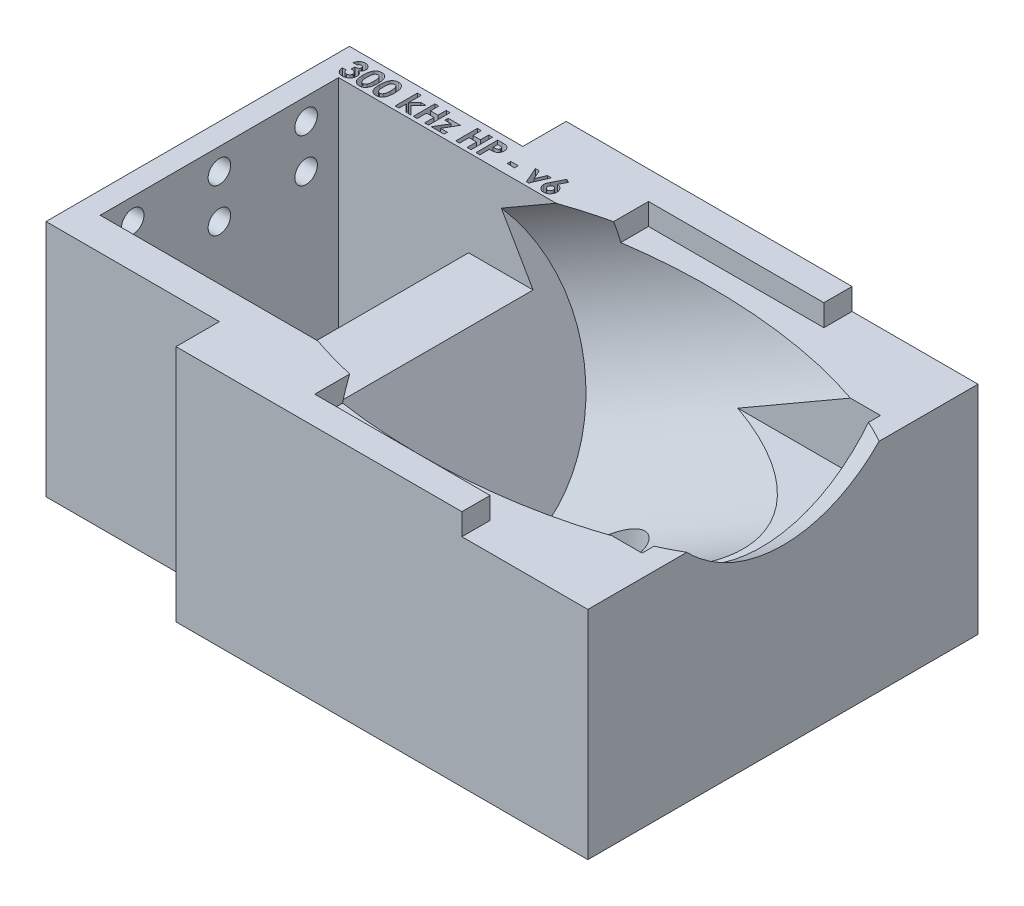
from build123d import *

# Parameters (mm, degrees)
SKETCH1_W                       = 228.6
SKETCH1_H                       = 127
BOSS_EXTRUDE1_DEPTH             = 50.8
SKETCH10_R                      = 12.7
CUT_EXTRUDE6_DEPTH              = 196.514014843
SKETCH22_W                      = 25.4
SKETCH22_H                      = 101.6
CUT_EXTRUDE17_DEPTH             = 196.514014908
SKETCH23_W                      = 254
SKETCH23_H                      = 254
CUT_EXTRUDE18_DEPTH             = 57.15
SKETCH21_W                      = 31.75
SKETCH21_H                      = 101.6
CUT_EXTRUDE16_DEPTH             = 144.262530042
SKETCH26_W                      = 158.75
SKETCH26_H                      = 69.85
CUT_EXTRUDE21_DEPTH             = 25.4
CUT_EXTRUDE22_REACH             = 193.976
SKETCH27_R                      = 3.302
CUT_EXTRUDE22_DIRECTION_2_DEPTH = 192.97594914
SKETCH28_W                      = 2.198076923
SKETCH28_H                      = 1.058333333
CUT_EXTRUDE23_DEPTH             = 3.175
SKETCH30_R                      = 3.429
CUT_EXTRUDE24_DEPTH             = 133.743860656
SKETCH31_W                      = 38.1
SKETCH31_H                      = 69.85
CUT_EXTRUDE25_DEPTH             = 38.1
SKETCH32_W                      = 88.276157737
SKETCH32_H                      = 97.79
CUT_EXTRUDE26_DEPTH             = 6.35
SKETCH33_W                      = 36.899714507
SKETCH33_H                      = 101.6
CUT_EXTRUDE27_DEPTH             = 6.35
BOSS_EXTRUDE2_DEPTH             = 6.35
BOSS_EXTRUDE3_DEPTH             = 6.35
SKETCH36_W                      = 50.8
SKETCH36_H                      = 12.7
CUT_EXTRUDE28_DEPTH             = 146.635280919


with BuildPart() as part:
    # Sketch1 → Boss-Extrude1 (new, symmetric)
    with BuildSketch(Plane.XY):
        with Locations((-25.4, -63.5)):
            Rectangle(SKETCH1_W, SKETCH1_H)
    extrude(amount=BOSS_EXTRUDE1_DEPTH, both=True)

    # Sketch10 → Cut-Extrude6 (cut, through all)
    with BuildSketch(Plane.XZ.offset(127)):
        with Locations(Location((0, 0, 0), (0, 0, 270))):
            Circle(SKETCH10_R)
    extrude(amount=-CUT_EXTRUDE6_DEPTH, mode=Mode.SUBTRACT)

    # Sketch2 → Cut-Revolve1 (revolve, cut)
    with BuildSketch(Plane.XY):
        Polygon((0, 46.586734405), (-47.920101674, 18.920050804), (-69.397531628, 6.520050839), (-50.142509297, -26.830626138), (-48.125031628, -30.324999965), (0, -2.54), (87.988181024, 48.26), (66.715681024, 85.105050804), align=None)
    revolve(axis=Axis((-48.125031628, -30.324999965, 0), (0.8660254037844379, 0.5000000000000012, 0)), mode=Mode.SUBTRACT)

    # Sketch22 → Cut-Extrude17 (cut, through all)
    with BuildSketch(Plane(origin=(0, 0, 0), x_dir=(1, 0, 0), z_dir=(0, 1, 0))):
        with Locations((-127, 0)):
            Rectangle(SKETCH22_W, SKETCH22_H)
    extrude(amount=-CUT_EXTRUDE17_DEPTH, mode=Mode.SUBTRACT)

    # Sketch23 → Cut-Extrude18 (cut)
    with BuildSketch(Plane.XZ.offset(127)):
        Rectangle(SKETCH23_W, SKETCH23_H)
    extrude(amount=-CUT_EXTRUDE18_DEPTH, mode=Mode.SUBTRACT)

    # Sketch21 → Cut-Extrude16 (cut, through all)
    with BuildSketch(Plane(origin=(0, 0, 0), x_dir=(1, 0, 0), z_dir=(0, 1, 0))):
        with Locations((73.025, 0)):
            Rectangle(SKETCH21_W, SKETCH21_H)
    extrude(amount=-CUT_EXTRUDE16_DEPTH, mode=Mode.SUBTRACT)

    # Sketch26 → Cut-Extrude21 (cut)
    with BuildSketch(Plane(origin=(0, 0, 0), x_dir=(1, 0, 0), z_dir=(0, 1, 0))):
        with Locations((-28.575, 0)):
            Rectangle(SKETCH26_W, SKETCH26_H)
    extrude(amount=-CUT_EXTRUDE21_DEPTH, mode=Mode.SUBTRACT)

    # Sketch27 → Cut-Extrude22 (cut, up to next)
    with BuildSketch(Plane.ZY.offset(114.3), mode=Mode.PRIVATE) as cut_extrude22_sk1:
        with Locations(Location((-25.4, -6.35, 0), (0, 0, 180))):
            Circle(SKETCH27_R)
    cut_extrude22_tool1 = extrude(cut_extrude22_sk1.sketch, amount=-CUT_EXTRUDE22_REACH, mode=Mode.PRIVATE) & part.part
    # Sketch27 → Cut-Extrude22 (cut, up to next)
    with BuildSketch(Plane.ZY.offset(114.3), mode=Mode.PRIVATE) as cut_extrude22_sk2:
        with Locations(Location((0, -6.35, 0), (0, 0, 180))):
            Circle(SKETCH27_R)
    cut_extrude22_tool2 = extrude(cut_extrude22_sk2.sketch, amount=-CUT_EXTRUDE22_REACH, mode=Mode.PRIVATE) & part.part
    # Sketch27 → Cut-Extrude22 (cut, up to next)
    with BuildSketch(Plane.ZY.offset(114.3), mode=Mode.PRIVATE) as cut_extrude22_sk3:
        with Locations(Location((0, -19.05, 0), (0, 0, 180))):
            Circle(SKETCH27_R)
    cut_extrude22_tool3 = extrude(cut_extrude22_sk3.sketch, amount=-CUT_EXTRUDE22_REACH, mode=Mode.PRIVATE) & part.part
    # Sketch27 → Cut-Extrude22 (cut, up to next)
    with BuildSketch(Plane.ZY.offset(114.3), mode=Mode.PRIVATE) as cut_extrude22_sk4:
        with Locations(Location((25.4, -6.35, 0), (0, 0, 180))):
            Circle(SKETCH27_R)
    cut_extrude22_tool4 = extrude(cut_extrude22_sk4.sketch, amount=-CUT_EXTRUDE22_REACH, mode=Mode.PRIVATE) & part.part
    # Sketch27 → Cut-Extrude22 (cut, up to next)
    with BuildSketch(Plane.ZY.offset(114.3), mode=Mode.PRIVATE) as cut_extrude22_sk5:
        with Locations(Location((25.4, -19.05, 0), (0, 0, 180))):
            Circle(SKETCH27_R)
    cut_extrude22_tool5 = extrude(cut_extrude22_sk5.sketch, amount=-CUT_EXTRUDE22_REACH, mode=Mode.PRIVATE) & part.part
    # Sketch27 → Cut-Extrude22 (cut, up to next)
    with BuildSketch(Plane.ZY.offset(114.3), mode=Mode.PRIVATE) as cut_extrude22_sk6:
        with Locations(Location((-25.4, -19.05, 0), (0, 0, 180))):
            Circle(SKETCH27_R)
    cut_extrude22_tool6 = extrude(cut_extrude22_sk6.sketch, amount=-CUT_EXTRUDE22_REACH, mode=Mode.PRIVATE) & part.part
    add(cut_extrude22_tool1.solids().sort_by_distance((-114.3, -6.35, -25.4))[0], mode=Mode.SUBTRACT)
    add(cut_extrude22_tool2.solids().sort_by_distance((-114.3, -6.35, 0))[0], mode=Mode.SUBTRACT)
    add(cut_extrude22_tool3.solids().sort_by_distance((-114.3, -19.05, 0))[0], mode=Mode.SUBTRACT)
    add(cut_extrude22_tool4.solids().sort_by_distance((-114.3, -6.35, 25.4))[0], mode=Mode.SUBTRACT)
    add(cut_extrude22_tool5.solids().sort_by_distance((-114.3, -19.05, 25.4))[0], mode=Mode.SUBTRACT)
    add(cut_extrude22_tool6.solids().sort_by_distance((-114.3, -19.05, -25.4))[0], mode=Mode.SUBTRACT)

    # Sketch27 → Cut-Extrude22 direction 2 (cut)
    with BuildSketch(Plane.ZY.offset(114.3)):
        with Locations(Location((-25.4, -6.35, 0), (0, 0, 180))):
            Circle(SKETCH27_R)
        with Locations(Location((0, -6.35, 0), (0, 0, 180))):
            Circle(SKETCH27_R)
        with Locations(Location((0, -19.05, 0), (0, 0, 180))):
            Circle(SKETCH27_R)
        with Locations(Location((25.4, -6.35, 0), (0, 0, 180))):
            Circle(SKETCH27_R)
        with Locations(Location((25.4, -19.05, 0), (0, 0, 180))):
            Circle(SKETCH27_R)
        with Locations(Location((-25.4, -19.05, 0), (0, 0, 180))):
            Circle(SKETCH27_R)
    extrude(amount=CUT_EXTRUDE22_DIRECTION_2_DEPTH, mode=Mode.SUBTRACT)

    # Sketch28 → Cut-Extrude23 (cut)
    # profile 1 of 11: a face of its own
    with BuildSketch(Plane(origin=(0, 0, 0), x_dir=(1, 0, 0), z_dir=(0, 1, 0))):
        with BuildLine():
            Line((-108.439595668, 40.823041991), (-109.579339258, 40.823041991))
            add(Edge.make_bspline(
                [(-109.579339258, 40.823041991), (-109.571292235, 40.880013707), (-109.555516579, 40.991702982), (-109.517767544, 41.15340123), (-109.472615625, 41.306783084), (-109.41624576, 41.451362816), (-109.35013308, 41.587397969), (-109.274949876, 41.71535535), (-109.18988339, 41.834685743), (-109.124679027, 41.906570845), (-109.092149755, 41.942433016)],
                knots=[0, 0, 0, 0, 1.111473889, 2.178970933, 3.205615836, 4.199322666, 5.174200091, 6.12565194, 7.064921805, 8, 8, 8, 8], degree=3))
            add(Edge.make_bspline(
                [(-109.092149755, 41.942433016), (-109.04523059, 41.989750553), (-108.952757848, 42.083008445), (-108.798225049, 42.202461503), (-108.636246138, 42.305840002), (-108.463572556, 42.387799223), (-108.282891233, 42.454135718), (-108.092765331, 42.498694091), (-107.893971771, 42.528258965), (-107.758320175, 42.531171208), (-107.689094867, 42.532657375)],
                knots=[0, 0, 0, 0, 1.01925491, 2.00884431, 2.983262333, 3.955970413, 4.92937149, 5.924503185, 6.940838805, 8, 8, 8, 8], degree=3))
            add(Edge.make_bspline(
                [(-107.689094867, 42.532657375), (-107.627550006, 42.531204422), (-107.506565211, 42.528348208), (-107.328748005, 42.505420072), (-107.15921418, 42.465206676), (-106.996171714, 42.412628563), (-106.84201843, 42.341087252), (-106.693352017, 42.258043018), (-106.554326218, 42.156185813), (-106.42461574, 42.041097423), (-106.305451927, 41.916618062), (-106.202255542, 41.783559862), (-106.113535759, 41.645477115), (-106.040442393, 41.501222613), (-105.984243527, 41.350552262), (-105.945239847, 41.194336462), (-105.919710992, 41.032919917), (-105.917167651, 40.923207266), (-105.915877719, 40.867563225)],
                knots=[0, 0, 0, 0, 1.091422571, 2.145516843, 3.172569842, 4.178562979, 5.178154469, 6.181868002, 7.194278174, 8.227918432, 9.254613415, 10.245994977, 11.209837596, 12.161663635, 13.10878368, 14.055455738, 15.013766427, 16, 16, 16, 16], degree=3))
            add(Edge.make_bspline(
                [(-105.915877719, 40.867563225), (-105.918524735, 40.798652714), (-105.923735896, 40.662989104), (-105.966497241, 40.464435331), (-106.033430374, 40.274582491), (-106.130121795, 40.09608691), (-106.251010699, 39.929434354), (-106.399337334, 39.780196517), (-106.570876975, 39.646033552), (-106.699654067, 39.573934358), (-106.765597271, 39.537014347)],
                knots=[0, 0, 0, 0, 0.992805628, 1.954529043, 2.915727527, 3.886831945, 4.871318353, 5.87440735, 6.911542536, 8, 8, 8, 8], degree=3))
            add(Edge.make_bspline(
                [(-106.765597271, 39.537014347), (-106.720334868, 39.522153747), (-106.631396276, 39.492953334), (-106.504980761, 39.435443453), (-106.384774052, 39.372594684), (-106.272846064, 39.299580983), (-106.16808354, 39.2193547), (-106.071125122, 39.13123003), (-105.981391508, 39.035399128), (-105.900347562, 38.931334959), (-105.828417893, 38.820701827), (-105.763879232, 38.706055293), (-105.710760316, 38.58565672), (-105.665761981, 38.460881142), (-105.631502811, 38.330607142), (-105.607381294, 38.195339519), (-105.593438465, 38.05538683), (-105.591311945, 37.960568968), (-105.590236694, 37.912625324)],
                knots=[0, 0, 0, 0, 1.059543567, 2.081955587, 3.086750234, 4.076226789, 5.052108497, 6.020845489, 6.989030705, 7.970690546, 8.952259656, 9.923888338, 10.895517021, 11.877585046, 12.873342345, 13.889638361, 14.932918083, 16, 16, 16, 16], degree=3))
            add(Edge.make_bspline(
                [(-105.590236694, 37.912625324), (-105.592416374, 37.842167634), (-105.596714258, 37.703239418), (-105.624038199, 37.498612373), (-105.674910453, 37.303518667), (-105.741835722, 37.11571345), (-105.831106766, 36.937621221), (-105.936163778, 36.765155005), (-106.065299953, 36.604295884), (-106.208812638, 36.450791159), (-106.368191842, 36.311231537), (-106.540984827, 36.190239624), (-106.723392024, 36.086407035), (-106.916567472, 36.002112782), (-107.120444057, 35.937196566), (-107.334567356, 35.890272133), (-107.559837056, 35.861562988), (-107.713601251, 35.858553379), (-107.792129723, 35.85701635)],
                knots=[0, 0, 0, 0, 1.005138573, 1.981928558, 2.936866704, 3.876260664, 4.820238198, 5.773547, 6.751179199, 7.756627054, 8.768222608, 9.766606018, 10.760583154, 11.757261445, 12.767156078, 13.807575856, 14.880313354, 16, 16, 16, 16], degree=3))
            add(Edge.make_bspline(
                [(-107.792129723, 35.85701635), (-107.86641639, 35.858636887), (-108.011674137, 35.861805633), (-108.224143994, 35.889232737), (-108.426076481, 35.933474881), (-108.617986934, 35.995837851), (-108.799132866, 36.076711966), (-108.971156979, 36.173014891), (-109.13062657, 36.290301154), (-109.279318443, 36.423276232), (-109.413934166, 36.57246672), (-109.53424892, 36.734416693), (-109.637609746, 36.909741981), (-109.724440526, 37.097693522), (-109.79406244, 37.298601039), (-109.848980002, 37.512055976), (-109.887340818, 37.738475358), (-109.899023685, 37.894256709), (-109.904980283, 37.973683016)],
                knots=[0, 0, 0, 0, 1.066544725, 2.085487077, 3.070979577, 4.031932826, 4.977951092, 5.916076795, 6.857635327, 7.814973522, 8.776389752, 9.738577119, 10.707772778, 11.69409279, 12.707140348, 13.757286496, 14.856535458, 16, 16, 16, 16], degree=3))
            Line((-109.904980283, 37.973683016), (-108.765236694, 37.973683016))
            add(Edge.make_bspline(
                [(-108.765236694, 37.973683016), (-108.758014257, 37.933746426), (-108.743946669, 37.855959444), (-108.7165087, 37.743341187), (-108.680753198, 37.639387579), (-108.639410942, 37.543174684), (-108.594755082, 37.453439261), (-108.540800124, 37.373495461), (-108.481499604, 37.301172481), (-108.395928521, 37.215194125), (-108.273598765, 37.126854954), (-108.108413067, 37.050084011), (-107.92465962, 37.005086807), (-107.796197635, 36.999597286), (-107.729799995, 36.996759939)],
                knots=[0, 0, 0, 0, 0.928156231, 1.807827665, 2.648129825, 3.438902246, 4.202261636, 4.936546065, 5.639352463, 6.338805438, 7.70633318, 9.064371875, 10.482673459, 12, 12, 12, 12], degree=3))
            add(Edge.make_bspline(
                [(-107.729799995, 36.996759939), (-107.69456706, 36.997364126), (-107.625553623, 36.998547592), (-107.524183161, 37.011664725), (-107.427613522, 37.033268655), (-107.335664841, 37.062627594), (-107.247751768, 37.09943086), (-107.165553968, 37.146886469), (-107.087396046, 37.202060389), (-107.01412765, 37.264090522), (-106.946426141, 37.331681163), (-106.890094505, 37.406526313), (-106.838611465, 37.482582364), (-106.800534238, 37.564825169), (-106.767170384, 37.648829187), (-106.746750001, 37.7376435), (-106.731331146, 37.829405024), (-106.730435064, 37.892202582), (-106.729980283, 37.924073641)],
                knots=[0, 0, 0, 0, 1.110435564, 2.175094844, 3.216326037, 4.226890168, 5.215276772, 6.21526065, 7.213097102, 8.228249917, 9.239874822, 10.221364777, 11.178138315, 12.128914389, 13.072518965, 14.022636769, 14.996447288, 16, 16, 16, 16], degree=3))
            add(Edge.make_bspline(
                [(-106.729980283, 37.924073641), (-106.73118764, 37.958930074), (-106.733591209, 38.028321246), (-106.753228623, 38.129583069), (-106.784240251, 38.226988782), (-106.827319189, 38.320107026), (-106.88484631, 38.408594586), (-106.952727671, 38.49422679), (-107.036311201, 38.572546634), (-107.128013528, 38.649963427), (-107.234352201, 38.717447522), (-107.350148378, 38.779725426), (-107.478445363, 38.829279411), (-107.616111312, 38.873540297), (-107.765750304, 38.905867762), (-107.926433137, 38.929340651), (-108.097900607, 38.94681258), (-108.216095362, 38.949319216), (-108.276775155, 38.950606093)],
                knots=[0, 0, 0, 0, 0.809814727, 1.612155564, 2.388397, 3.182215007, 3.988903953, 4.837162975, 5.715530372, 6.646997145, 7.623086902, 8.637258368, 9.698941581, 10.815059213, 11.996518529, 13.252603015, 14.589518788, 16, 16, 16, 16], degree=3))
            Line((-108.276775155, 38.950606093), (-108.276775155, 40.008939427))
            add(Edge.make_bspline(
                [(-108.276775155, 40.008939427), (-108.201225204, 40.015373502), (-108.059886206, 40.027410384), (-107.863700099, 40.055559049), (-107.698536686, 40.093184375), (-107.560426262, 40.138577293), (-107.445748216, 40.196873627), (-107.345566107, 40.261230206), (-107.259284537, 40.335970966), (-107.186365035, 40.418867149), (-107.128031703, 40.507889877), (-107.086746769, 40.601655471), (-107.059484355, 40.69726271), (-107.056901244, 40.762655179), (-107.055621309, 40.795057215)],
                knots=[0, 0, 0, 0, 1.70044513, 3.18119609, 4.440695891, 5.496282586, 6.431922213, 7.318171381, 8.16090191, 8.983045123, 9.787564368, 10.536848927, 11.275007137, 12, 12, 12, 12], degree=3))
            add(Edge.make_bspline(
                [(-107.055621309, 40.795057215), (-107.057829562, 40.836398695), (-107.062139605, 40.917088511), (-107.095613734, 41.032572635), (-107.153721029, 41.135517161), (-107.231632708, 41.225705463), (-107.326570798, 41.301037492), (-107.437854882, 41.355727261), (-107.56307009, 41.387859942), (-107.651165735, 41.391191018), (-107.696727078, 41.392913786)],
                knots=[0, 0, 0, 0, 1.009664648, 1.970651636, 2.907870547, 3.878035693, 4.867062054, 5.849714035, 6.887914197, 8, 8, 8, 8], degree=3))
            add(Edge.make_bspline(
                [(-107.696727078, 41.392913786), (-107.738023313, 41.390881101), (-107.819967691, 41.386847633), (-107.939794899, 41.356742892), (-108.053590825, 41.306065308), (-108.158999075, 41.236183907), (-108.254498061, 41.152259306), (-108.332875175, 41.052868036), (-108.398065543, 40.9439648), (-108.425698023, 40.863507611), (-108.439595668, 40.823041991)],
                knots=[0, 0, 0, 0, 0.98818071, 1.960853194, 2.938124878, 3.957524365, 4.978590984, 5.968022688, 6.978025184, 8, 8, 8, 8], degree=3))
        make_face()
    # profile 2 of 11: a face of its own
    with BuildSketch(Plane(origin=(0, 0, 0), x_dir=(1, 0, 0), z_dir=(0, 1, 0))):
        with BuildLine():
            add(Edge.make_bspline(
                [(-102.882073633, 42.532657375), (-102.826905313, 42.531838386), (-102.718429655, 42.530228034), (-102.55866543, 42.512786614), (-102.40476831, 42.486437491), (-102.25613623, 42.449689654), (-102.113839057, 42.401055199), (-101.976841125, 42.342840591), (-101.846773105, 42.271992353), (-101.721976214, 42.19196563), (-101.602498525, 42.101364034), (-101.491211599, 41.998073537), (-101.386083101, 41.884470857), (-101.289388676, 41.758838526), (-101.198986996, 41.622319302), (-101.115175106, 41.474891538), (-101.038594608, 41.315833674), (-100.968387215, 41.144858678), (-100.905607543, 40.959403708), (-100.852728303, 40.757341515), (-100.807375507, 40.538625954), (-100.769094546, 40.302712611), (-100.740160327, 40.049287898), (-100.720658081, 39.77852018), (-100.707274717, 39.490931456), (-100.70618246, 39.293647954), (-100.705621309, 39.192292792)],
                knots=[0, 0, 0, 0, 0.879237366, 1.728815576, 2.559023295, 3.367336655, 4.166867292, 4.954216142, 5.737608147, 6.525189134, 7.316157332, 8.124696809, 8.942788509, 9.781158001, 10.649253743, 11.551476218, 12.482711956, 13.461909668, 14.496590415, 15.601789533, 16.789733467, 18.056700938, 19.410929216, 20.8549011, 22.384193279, 24, 24, 24, 24], degree=3))
            add(Edge.make_bspline(
                [(-100.705621309, 39.192292792), (-100.706227762, 39.089669563), (-100.707406089, 38.89027447), (-100.720101731, 38.600055314), (-100.741964227, 38.327321659), (-100.770142189, 38.072101723), (-100.80873829, 37.834530282), (-100.853939689, 37.613992186), (-100.907653612, 37.410567376), (-100.972501226, 37.22471421), (-101.042283652, 37.053438944), (-101.119073631, 36.894691206), (-101.201532725, 36.748041017), (-101.287769572, 36.611275962), (-101.382511992, 36.488427804), (-101.481148604, 36.375319063), (-101.587974223, 36.276258196), (-101.698491078, 36.186140052), (-101.816747847, 36.10825989), (-101.94152498, 36.040147184), (-102.075047036, 35.984899691), (-102.214880136, 35.936848371), (-102.363407762, 35.902352709), (-102.518269832, 35.874981534), (-102.681214706, 35.859854544), (-102.79215414, 35.857977941), (-102.849000716, 35.85701635)],
                knots=[0, 0, 0, 0, 1.643780988, 3.193836972, 4.651895693, 6.025988579, 7.305620092, 8.505800249, 9.631074763, 10.672816429, 11.65661981, 12.592235626, 13.49536222, 14.350718032, 15.179365177, 15.97804903, 16.751647189, 17.51006938, 18.259804725, 19.016521909, 19.783502495, 20.571750527, 21.382245291, 22.22305063, 23.089471752, 24, 24, 24, 24], degree=3))
            add(Edge.make_bspline(
                [(-102.849000716, 35.85701635), (-102.905845758, 35.85799649), (-103.01720436, 35.85991657), (-103.180589853, 35.874869058), (-103.336272614, 35.90246359), (-103.485975333, 35.937113203), (-103.628656102, 35.984793372), (-103.764999071, 36.041693832), (-103.893955882, 36.109381548), (-104.015883594, 36.187443163), (-104.130365913, 36.276958349), (-104.239181892, 36.37696964), (-104.342090825, 36.487223534), (-104.437527211, 36.608954965), (-104.527054023, 36.740539073), (-104.609737636, 36.883478484), (-104.685528362, 37.037565081), (-104.756796946, 37.203013646), (-104.818720325, 37.383386097), (-104.873829257, 37.580293136), (-104.918973045, 37.795376147), (-104.955280699, 38.028566031), (-104.98426871, 38.279368765), (-105.005832458, 38.547905405), (-105.018598619, 38.834301029), (-105.019764588, 39.031155007), (-105.020364899, 39.132507135)],
                knots=[0, 0, 0, 0, 0.917216111, 1.796812873, 2.643793957, 3.46689424, 4.273913431, 5.068098542, 5.848489301, 6.620921603, 7.401012384, 8.190319798, 9.003608147, 9.831726257, 10.68377682, 11.569763213, 12.493818149, 13.453288342, 14.474581811, 15.568529029, 16.750744269, 18.018426408, 19.375425659, 20.823733699, 22.36466933, 24, 24, 24, 24], degree=3))
            add(Edge.make_bspline(
                [(-105.020364899, 39.132507135), (-105.019277492, 39.273327938), (-105.017179328, 39.545043491), (-104.990589845, 39.937593463), (-104.951563229, 40.300437914), (-104.894242373, 40.632969892), (-104.823365929, 40.936421), (-104.732604951, 41.208792261), (-104.62928018, 41.453852541), (-104.5412342, 41.599027727), (-104.498830444, 41.668945436)],
                knots=[0, 0, 0, 0, 1.288568992, 2.486310467, 3.599230591, 4.627010532, 5.572937695, 6.447898582, 7.252493626, 8, 8, 8, 8], degree=3))
            add(Edge.make_bspline(
                [(-104.498830444, 41.668945436), (-104.449525375, 41.737632572), (-104.353124251, 41.871929459), (-104.184564191, 42.048236167), (-104.003468352, 42.199022297), (-103.80611713, 42.320875424), (-103.595631717, 42.416968809), (-103.370204987, 42.484838486), (-103.130669404, 42.524382521), (-102.966176324, 42.529857901), (-102.882073633, 42.532657375)],
                knots=[0, 0, 0, 0, 1.058512271, 2.069600068, 3.047294572, 4.004278952, 4.967380941, 5.939006123, 6.946246673, 8, 8, 8, 8], degree=3))
        make_face()
        with BuildLine():
            add(Edge.make_bspline(
                [(-102.854088857, 41.392913786), (-102.903961476, 41.390549923), (-103.001738283, 41.385915496), (-103.143617089, 41.346575756), (-103.277399945, 41.285813406), (-103.37916499, 41.212695417), (-103.455335114, 41.142603057), (-103.508555726, 41.07917175), (-103.559878618, 41.008386984), (-103.60520958, 40.927054605), (-103.648013842, 40.838096982), (-103.689846508, 40.7411103), (-103.72413831, 40.633712357), (-103.757829096, 40.517732154), (-103.787345368, 40.389963146), (-103.812073533, 40.249360963), (-103.834165975, 40.095011255), (-103.849575717, 39.926812923), (-103.86394222, 39.744941945), (-103.874240811, 39.548993182), (-103.878546393, 39.339019497), (-103.879915006, 39.194413736), (-103.880621309, 39.119786782)],
                knots=[0, 0, 0, 0, 1.076674018, 2.110852608, 3.161083442, 4.239746716, 4.804137807, 5.395870207, 6.026861976, 6.692161227, 7.405688833, 8.16177676, 8.973626916, 9.841385931, 10.773283133, 11.807421078, 12.927755683, 14.143907515, 15.458935494, 16.872852025, 18.386167141, 20, 20, 20, 20], degree=3))
            add(Edge.make_bspline(
                [(-103.880621309, 39.119786782), (-103.87945882, 39.023103956), (-103.877229662, 38.837707467), (-103.865554372, 38.571100861), (-103.842152222, 38.328467382), (-103.813044673, 38.108162613), (-103.772161932, 37.911615289), (-103.725123692, 37.73696589), (-103.667035647, 37.586440772), (-103.59990372, 37.457863004), (-103.525552085, 37.348482163), (-103.444840115, 37.255507956), (-103.360515762, 37.174996679), (-103.26994699, 37.109598361), (-103.173349869, 37.059480104), (-103.071530807, 37.023430661), (-102.964425099, 37.001363296), (-102.891080214, 36.998303262), (-102.854088857, 36.996759939)],
                knots=[0, 0, 0, 0, 1.771748488, 3.397459088, 4.888034009, 6.237357457, 7.467047327, 8.564189669, 9.548206622, 10.417051504, 11.216568818, 11.965764335, 12.669334354, 13.348544111, 14.005342236, 14.656555988, 15.322436492, 16, 16, 16, 16], degree=3))
            add(Edge.make_bspline(
                [(-102.854088857, 36.996759939), (-102.818366926, 36.997815995), (-102.748427827, 36.999883622), (-102.646440957, 37.021107527), (-102.549994925, 37.055612988), (-102.459380933, 37.104423385), (-102.374274868, 37.166493273), (-102.295092674, 37.242095413), (-102.222431528, 37.331983383), (-102.180098815, 37.398693551), (-102.158285572, 37.433068032)],
                knots=[0, 0, 0, 0, 0.992283464, 1.942767638, 2.88273346, 3.832339453, 4.79467288, 5.803907806, 6.868395428, 8, 8, 8, 8], degree=3))
            add(Edge.make_bspline(
                [(-102.158285572, 37.433068032), (-102.132604152, 37.480039663), (-102.078752298, 37.578535363), (-102.01643484, 37.744743184), (-101.963979477, 37.932198135), (-101.918831912, 38.141483595), (-101.887953733, 38.373425011), (-101.861361482, 38.626551622), (-101.848535379, 38.902138072), (-101.846449143, 39.093065359), (-101.845364899, 39.192292792)],
                knots=[0, 0, 0, 0, 0.710965849, 1.490837728, 2.352621235, 3.297892224, 4.334225155, 5.461620853, 6.680770821, 8, 8, 8, 8], degree=3))
            add(Edge.make_bspline(
                [(-101.845364899, 39.192292792), (-101.845783719, 39.292381567), (-101.846589876, 39.485035374), (-101.861380526, 39.761612576), (-101.881977637, 40.014219949), (-101.912105264, 40.242293522), (-101.950869932, 40.446386958), (-101.998647532, 40.626486915), (-102.054973767, 40.782948336), (-102.12176997, 40.915615207), (-102.195750915, 41.028363849), (-102.274283947, 41.125093438), (-102.357701135, 41.20767872), (-102.445862978, 41.27643048), (-102.540810013, 41.32896198), (-102.640728629, 41.366053565), (-102.745823665, 41.38849273), (-102.817513358, 41.391420209), (-102.854088857, 41.392913786)],
                knots=[0, 0, 0, 0, 1.793836731, 3.452829483, 4.963243077, 6.335886805, 7.574563692, 8.684454726, 9.672768357, 10.54971625, 11.340229787, 12.085688095, 12.778991901, 13.440269426, 14.083255152, 14.715733572, 15.344777694, 16, 16, 16, 16], degree=3))
        make_face(mode=Mode.SUBTRACT)
    # profile 3 of 11: a face of its own
    with BuildSketch(Plane(origin=(0, 0, 0), x_dir=(1, 0, 0), z_dir=(0, 1, 0))):
        with BuildLine():
            add(Edge.make_bspline(
                [(-97.997458248, 42.532657375), (-97.942289928, 42.531838386), (-97.83381427, 42.530228034), (-97.674050046, 42.512786614), (-97.520152926, 42.486437491), (-97.371520845, 42.449689654), (-97.229223673, 42.401055199), (-97.092225741, 42.342840591), (-96.962157721, 42.271992353), (-96.83736083, 42.19196563), (-96.71788314, 42.101364034), (-96.606596214, 41.998073537), (-96.501467716, 41.884470857), (-96.404773291, 41.758838526), (-96.314371611, 41.622319302), (-96.230559722, 41.474891538), (-96.153979223, 41.315833674), (-96.083771831, 41.144858678), (-96.020992158, 40.959403708), (-95.968112919, 40.757341515), (-95.922760122, 40.538625954), (-95.884479162, 40.302712611), (-95.855544943, 40.049287898), (-95.836042697, 39.77852018), (-95.822659333, 39.490931456), (-95.821567076, 39.293647954), (-95.821005924, 39.192292792)],
                knots=[0, 0, 0, 0, 0.879237366, 1.728815576, 2.559023295, 3.367336655, 4.166867292, 4.954216142, 5.737608147, 6.525189134, 7.316157332, 8.124696809, 8.942788509, 9.781158001, 10.649253743, 11.551476218, 12.482711956, 13.461909668, 14.496590415, 15.601789533, 16.789733467, 18.056700938, 19.410929216, 20.8549011, 22.384193279, 24, 24, 24, 24], degree=3))
            add(Edge.make_bspline(
                [(-95.821005924, 39.192292792), (-95.821612377, 39.089669563), (-95.822790704, 38.89027447), (-95.835486347, 38.600055314), (-95.857348842, 38.327321659), (-95.885526805, 38.072101723), (-95.924122905, 37.834530282), (-95.969324304, 37.613992186), (-96.023038227, 37.410567376), (-96.087885842, 37.22471421), (-96.157668267, 37.053438944), (-96.234458246, 36.894691206), (-96.316917341, 36.748041017), (-96.403154187, 36.611275962), (-96.497896607, 36.488427804), (-96.59653322, 36.375319063), (-96.703358839, 36.276258196), (-96.813875693, 36.186140052), (-96.932132462, 36.10825989), (-97.056909595, 36.040147184), (-97.190431651, 35.984899691), (-97.330264751, 35.936848371), (-97.478792377, 35.902352709), (-97.633654447, 35.874981534), (-97.796599321, 35.859854544), (-97.907538755, 35.857977941), (-97.964385332, 35.85701635)],
                knots=[0, 0, 0, 0, 1.643780988, 3.193836972, 4.651895693, 6.025988579, 7.305620092, 8.505800249, 9.631074763, 10.672816429, 11.65661981, 12.592235626, 13.49536222, 14.350718032, 15.179365177, 15.97804903, 16.751647189, 17.51006938, 18.259804725, 19.016521909, 19.783502495, 20.571750527, 21.382245291, 22.22305063, 23.089471752, 24, 24, 24, 24], degree=3))
            add(Edge.make_bspline(
                [(-97.964385332, 35.85701635), (-98.021230374, 35.85799649), (-98.132588975, 35.85991657), (-98.295974469, 35.874869058), (-98.451657229, 35.90246359), (-98.601359948, 35.937113203), (-98.744040717, 35.984793372), (-98.880383687, 36.041693832), (-99.009340497, 36.109381548), (-99.131268209, 36.187443163), (-99.245750528, 36.276958349), (-99.354566507, 36.37696964), (-99.45747544, 36.487223534), (-99.552911827, 36.608954965), (-99.642438638, 36.740539073), (-99.725122252, 36.883478484), (-99.800912977, 37.037565081), (-99.872181562, 37.203013646), (-99.93410494, 37.383386097), (-99.989213872, 37.580293136), (-100.03435766, 37.795376147), (-100.070665315, 38.028566031), (-100.099653325, 38.279368765), (-100.121217073, 38.547905405), (-100.133983234, 38.834301029), (-100.135149204, 39.031155007), (-100.135749514, 39.132507135)],
                knots=[0, 0, 0, 0, 0.917216111, 1.796812873, 2.643793957, 3.46689424, 4.273913431, 5.068098542, 5.848489301, 6.620921603, 7.401012384, 8.190319798, 9.003608147, 9.831726257, 10.68377682, 11.569763213, 12.493818149, 13.453288342, 14.474581811, 15.568529029, 16.750744269, 18.018426408, 19.375425659, 20.823733699, 22.36466933, 24, 24, 24, 24], degree=3))
            add(Edge.make_bspline(
                [(-100.135749514, 39.132507135), (-100.134662108, 39.273327938), (-100.132563943, 39.545043491), (-100.105974461, 39.937593463), (-100.066947844, 40.300437914), (-100.009626989, 40.632969892), (-99.938750544, 40.936421), (-99.847989566, 41.208792261), (-99.744664795, 41.453852541), (-99.656618816, 41.599027727), (-99.614215059, 41.668945436)],
                knots=[0, 0, 0, 0, 1.288568992, 2.486310467, 3.599230591, 4.627010532, 5.572937695, 6.447898582, 7.252493626, 8, 8, 8, 8], degree=3))
            add(Edge.make_bspline(
                [(-99.614215059, 41.668945436), (-99.564909991, 41.737632572), (-99.468508867, 41.871929459), (-99.299948806, 42.048236167), (-99.118852968, 42.199022297), (-98.921501746, 42.320875424), (-98.711016332, 42.416968809), (-98.485589602, 42.484838486), (-98.246054019, 42.524382521), (-98.081560939, 42.529857901), (-97.997458248, 42.532657375)],
                knots=[0, 0, 0, 0, 1.058512271, 2.069600068, 3.047294572, 4.004278952, 4.967380941, 5.939006123, 6.946246673, 8, 8, 8, 8], degree=3))
        make_face()
        with BuildLine():
            add(Edge.make_bspline(
                [(-97.969473473, 41.392913786), (-98.019346092, 41.390549923), (-98.117122899, 41.385915496), (-98.259001705, 41.346575756), (-98.39278456, 41.285813406), (-98.494549605, 41.212695417), (-98.570719729, 41.142603057), (-98.623940341, 41.07917175), (-98.675263233, 41.008386984), (-98.720594196, 40.927054605), (-98.763398458, 40.838096982), (-98.805231124, 40.7411103), (-98.839522925, 40.633712357), (-98.873213711, 40.517732154), (-98.902729983, 40.389963146), (-98.927458148, 40.249360963), (-98.94955059, 40.095011255), (-98.964960332, 39.926812923), (-98.979326836, 39.744941945), (-98.989625426, 39.548993182), (-98.993931008, 39.339019497), (-98.995299622, 39.194413736), (-98.996005924, 39.119786782)],
                knots=[0, 0, 0, 0, 1.076674018, 2.110852608, 3.161083442, 4.239746716, 4.804137807, 5.395870207, 6.026861976, 6.692161227, 7.405688833, 8.16177676, 8.973626916, 9.841385931, 10.773283133, 11.807421078, 12.927755683, 14.143907515, 15.458935494, 16.872852025, 18.386167141, 20, 20, 20, 20], degree=3))
            add(Edge.make_bspline(
                [(-98.996005924, 39.119786782), (-98.994843436, 39.023103956), (-98.992614277, 38.837707467), (-98.980938987, 38.571100861), (-98.957536838, 38.328467382), (-98.928429289, 38.108162613), (-98.887546547, 37.911615289), (-98.840508307, 37.73696589), (-98.782420263, 37.586440772), (-98.715288335, 37.457863004), (-98.6409367, 37.348482163), (-98.56022473, 37.255507956), (-98.475900378, 37.174996679), (-98.385331606, 37.109598361), (-98.288734485, 37.059480104), (-98.186915422, 37.023430661), (-98.079809714, 37.001363296), (-98.00646483, 36.998303262), (-97.969473473, 36.996759939)],
                knots=[0, 0, 0, 0, 1.771748488, 3.397459088, 4.888034009, 6.237357457, 7.467047327, 8.564189669, 9.548206622, 10.417051504, 11.216568818, 11.965764335, 12.669334354, 13.348544111, 14.005342236, 14.656555988, 15.322436492, 16, 16, 16, 16], degree=3))
            add(Edge.make_bspline(
                [(-97.969473473, 36.996759939), (-97.933751541, 36.997815995), (-97.863812442, 36.999883622), (-97.761825572, 37.021107527), (-97.665379541, 37.055612988), (-97.574765549, 37.104423385), (-97.489659483, 37.166493273), (-97.410477289, 37.242095413), (-97.337816143, 37.331983383), (-97.29548343, 37.398693551), (-97.273670187, 37.433068032)],
                knots=[0, 0, 0, 0, 0.992283464, 1.942767638, 2.88273346, 3.832339453, 4.79467288, 5.803907806, 6.868395428, 8, 8, 8, 8], degree=3))
            add(Edge.make_bspline(
                [(-97.273670187, 37.433068032), (-97.247988768, 37.480039663), (-97.194136914, 37.578535363), (-97.131819455, 37.744743184), (-97.079364092, 37.932198135), (-97.034216528, 38.141483595), (-97.003338348, 38.373425011), (-96.976746097, 38.626551622), (-96.963919994, 38.902138072), (-96.961833758, 39.093065359), (-96.960749514, 39.192292792)],
                knots=[0, 0, 0, 0, 0.710965849, 1.490837728, 2.352621235, 3.297892224, 4.334225155, 5.461620853, 6.680770821, 8, 8, 8, 8], degree=3))
            add(Edge.make_bspline(
                [(-96.960749514, 39.192292792), (-96.961168334, 39.292381567), (-96.961974492, 39.485035374), (-96.976765142, 39.761612576), (-96.997362252, 40.014219949), (-97.027489879, 40.242293522), (-97.066254547, 40.446386958), (-97.114032147, 40.626486915), (-97.170358383, 40.782948336), (-97.237154586, 40.915615207), (-97.311135531, 41.028363849), (-97.389668562, 41.125093438), (-97.47308575, 41.20767872), (-97.561247593, 41.27643048), (-97.656194629, 41.32896198), (-97.756113244, 41.366053565), (-97.86120828, 41.38849273), (-97.932897973, 41.391420209), (-97.969473473, 41.392913786)],
                knots=[0, 0, 0, 0, 1.793836731, 3.452829483, 4.963243077, 6.335886805, 7.574563692, 8.684454726, 9.672768357, 10.54971625, 11.340229787, 12.085688095, 12.778991901, 13.440269426, 14.083255152, 14.715733572, 15.344777694, 16, 16, 16, 16], degree=3))
        make_face(mode=Mode.SUBTRACT)
    # profile 4 of 11: a face of its own
    with BuildSketch(Plane(origin=(0, 0, 0), x_dir=(1, 0, 0), z_dir=(0, 1, 0))):
        Polygon((-92.483185412, 42.532657375), (-91.343441822, 42.532657375), (-91.343441822, 38.7343601), (-89.570224674, 40.660221478), (-88.162081646, 40.660221478), (-90.198610091, 38.448152167), (-87.870785572, 36.019836863), (-89.305641341, 36.019836863), (-91.343441822, 38.145407776), (-91.343441822, 36.019836863), (-92.483185412, 36.019836863), align=None)
    # profile 5 of 11: a face of its own
    with BuildSketch(Plane(origin=(0, 0, 0), x_dir=(1, 0, 0), z_dir=(0, 1, 0))):
        Polygon((-87.191518745, 42.369836863), (-86.051775155, 42.369836863), (-86.051775155, 39.92752917), (-83.853698232, 39.92752917), (-83.853698232, 42.369836863), (-82.713954642, 42.369836863), (-82.713954642, 36.019836863), (-83.853698232, 36.019836863), (-83.853698232, 38.78778558), (-86.051775155, 38.78778558), (-86.051775155, 36.019836863), (-87.191518745, 36.019836863), align=None)
    # profile 6 of 11: a face of its own
    with BuildSketch(Plane(origin=(0, 0, 0), x_dir=(1, 0, 0), z_dir=(0, 1, 0))):
        Polygon((-81.574211053, 40.660221478), (-77.992159771, 40.660221478), (-80.126634931, 36.996759939), (-78.154980283, 36.996759939), (-78.154980283, 36.019836863), (-81.899852078, 36.019836863), (-79.765376918, 39.683298401), (-81.574211053, 39.683298401), align=None)
    # profile 7 of 11: a face of its own
    with BuildSketch(Plane(origin=(0, 0, 0), x_dir=(1, 0, 0), z_dir=(0, 1, 0))):
        Polygon((-74.735749514, 42.369836863), (-73.596005924, 42.369836863), (-73.596005924, 39.92752917), (-71.397929001, 39.92752917), (-71.397929001, 42.369836863), (-70.258185412, 42.369836863), (-70.258185412, 36.019836863), (-71.397929001, 36.019836863), (-71.397929001, 38.78778558), (-73.596005924, 38.78778558), (-73.596005924, 36.019836863), (-74.735749514, 36.019836863), align=None)
    # profile 8 of 11: a face of its own
    with BuildSketch(Plane(origin=(0, 0, 0), x_dir=(1, 0, 0), z_dir=(0, 1, 0))):
        with BuildLine():
            Line((-68.792800796, 42.369836863), (-67.52076554, 42.369836863))
            add(Edge.make_bspline(
                [(-67.52076554, 42.369836863), (-67.437652406, 42.36946483), (-67.27730975, 42.368747103), (-67.046082448, 42.360043698), (-66.832763941, 42.344446666), (-66.637403237, 42.325171201), (-66.460080665, 42.298147749), (-66.300574163, 42.267167478), (-66.158850631, 42.229424491), (-66.033311923, 42.184624088), (-65.920644989, 42.131806163), (-65.81402573, 42.075551303), (-65.715863754, 42.008413112), (-65.62120453, 41.937627459), (-65.535459889, 41.856432217), (-65.453280566, 41.770231048), (-65.378147081, 41.675605284), (-65.309711291, 41.573700345), (-65.247629486, 41.466398998), (-65.193390667, 41.35350942), (-65.149395174, 41.234852976), (-65.112488427, 41.111197237), (-65.082844568, 40.982547592), (-65.063112671, 40.848112836), (-65.049709775, 40.708831642), (-65.048527154, 40.614036774), (-65.047929001, 40.566090869)],
                knots=[0, 0, 0, 0, 1.698747864, 3.27724071, 4.728299578, 6.070144658, 7.288476769, 8.393259625, 9.389771311, 10.283485332, 11.113357557, 11.931608583, 12.74405601, 13.541433047, 14.344816069, 15.154114104, 15.974336324, 16.810834471, 17.661136416, 18.50621059, 19.367396281, 20.244825668, 21.142564693, 22.063065223, 23.020325768, 24, 24, 24, 24], degree=3))
            add(Edge.make_bspline(
                [(-65.047929001, 40.566090869), (-65.048794454, 40.513049456), (-65.050495173, 40.408816563), (-65.067167709, 40.256023928), (-65.095649666, 40.110349985), (-65.132874095, 39.970566238), (-65.184780914, 39.838972441), (-65.244082017, 39.712428724), (-65.317041184, 39.594482986), (-65.400408695, 39.483659867), (-65.491455529, 39.379058322), (-65.592343132, 39.283698524), (-65.701148544, 39.196930408), (-65.817241929, 39.117844638), (-65.941059137, 39.046600746), (-66.072510828, 38.982531611), (-66.212494627, 38.92768636), (-66.309975134, 38.899002739), (-66.359397351, 38.88446026)],
                knots=[0, 0, 0, 0, 1.102006807, 2.165578795, 3.188629044, 4.184801286, 5.166646146, 6.124351954, 7.085497154, 8.042432466, 9.003981491, 9.963833307, 10.922997304, 11.89326795, 12.880200226, 13.889073926, 14.929769137, 16, 16, 16, 16], degree=3))
            add(Edge.make_bspline(
                [(-66.359397351, 38.88446026), (-66.391949666, 38.876361191), (-66.462468463, 38.858816), (-66.579157703, 38.841003228), (-66.7136298, 38.824625479), (-66.866319591, 38.810550787), (-67.037315104, 38.800983275), (-67.226450772, 38.793511474), (-67.433812308, 38.788078704), (-67.57800332, 38.787885925), (-67.653057207, 38.78778558)],
                knots=[0, 0, 0, 0, 0.618981996, 1.340914327, 2.176866532, 3.120127938, 4.170906482, 5.338178032, 6.614476169, 8, 8, 8, 8], degree=3))
            Line((-67.653057207, 38.78778558), (-67.653057207, 36.019836863))
            Line((-67.653057207, 36.019836863), (-68.792800796, 36.019836863))
            Line((-68.792800796, 36.019836863), (-68.792800796, 42.369836863))
        make_face()
        with BuildLine():
            Line((-67.653057207, 39.92752917), (-67.24982203, 39.92752917))
            add(Edge.make_bspline(
                [(-67.24982203, 39.92752917), (-67.176447024, 39.927994425), (-67.041435922, 39.9288505), (-66.857058433, 39.941229845), (-66.708889137, 39.960135604), (-66.591832641, 39.987250836), (-66.499405451, 40.028401791), (-66.419692785, 40.076005697), (-66.351321197, 40.136199528), (-66.292121465, 40.204981281), (-66.244793064, 40.284014961), (-66.211973282, 40.372013661), (-66.190654198, 40.467128431), (-66.188685182, 40.533322016), (-66.187672591, 40.567362904)],
                knots=[0, 0, 0, 0, 1.8619151, 3.425951444, 4.686033666, 5.651700536, 6.461346321, 7.243864085, 7.999046032, 8.762387399, 9.539336099, 10.322741239, 11.137448474, 12, 12, 12, 12], degree=3))
            add(Edge.make_bspline(
                [(-66.187672591, 40.567362904), (-66.188674766, 40.597103985), (-66.190619227, 40.654808832), (-66.204903766, 40.738091239), (-66.227669213, 40.815727623), (-66.260655469, 40.886907175), (-66.303298889, 40.951508948), (-66.355289846, 41.009507495), (-66.415961196, 41.062144902), (-66.462803025, 41.090006686), (-66.486600876, 41.104161782)],
                knots=[0, 0, 0, 0, 1.102301479, 2.1387299, 3.123554645, 4.094223062, 5.036071848, 5.982632524, 6.975082478, 8, 8, 8, 8], degree=3))
            add(Edge.make_bspline(
                [(-66.486600876, 41.104161782), (-66.50675903, 41.114356339), (-66.549437973, 41.135940304), (-66.62212435, 41.161033242), (-66.706003319, 41.182201899), (-66.801641158, 41.19977168), (-66.90865634, 41.213407654), (-67.027029772, 41.223835764), (-67.15693565, 41.228029313), (-67.247277416, 41.22938631), (-67.294343264, 41.230093273)],
                knots=[0, 0, 0, 0, 0.656809284, 1.390599849, 2.23162475, 3.173112763, 4.218524733, 5.370385145, 6.63003504, 8, 8, 8, 8], degree=3))
            Line((-67.294343264, 41.230093273), (-67.653057207, 41.230093273))
            Line((-67.653057207, 41.230093273), (-67.653057207, 39.92752917))
        make_face(mode=Mode.SUBTRACT)
    # profile 9 of 11: a face of its own
    with BuildSketch(Plane(origin=(0, 0, 0), x_dir=(1, 0, 0), z_dir=(0, 1, 0))):
        with Locations((-60.366839258, 38.340029171)):
            Rectangle(SKETCH28_W, SKETCH28_H)
    # profile 10 of 11: a face of its own
    with BuildSketch(Plane(origin=(0, 0, 0), x_dir=(1, 0, 0), z_dir=(0, 1, 0))):
        Polygon((-56.052095668, 40.660221478), (-54.891999514, 40.660221478), (-53.691198232, 37.921529571), (-52.49039695, 40.660221478), (-51.330300796, 40.660221478), (-53.363013136, 36.019836863), (-54.019383328, 36.019836863), align=None)
    # profile 11 of 11: a face of its own
    with BuildSketch(Plane(origin=(0, 0, 0), x_dir=(1, 0, 0), z_dir=(0, 1, 0))):
        with BuildLine():
            Line((-48.709908168, 42.532657375), (-47.70118421, 42.021299202))
            Line((-47.70118421, 42.021299202), (-48.807854883, 39.846118914))
            add(Edge.make_bspline(
                [(-48.807854883, 39.846118914), (-48.742473818, 39.844426165), (-48.613695088, 39.841092019), (-48.424223318, 39.814144891), (-48.243084779, 39.767559769), (-48.068453059, 39.705811316), (-47.902462865, 39.62288253), (-47.742440833, 39.524234413), (-47.592526814, 39.403922423), (-47.449283407, 39.270623122), (-47.319032913, 39.122946653), (-47.205887332, 38.964263597), (-47.107282955, 38.79843473), (-47.030631881, 38.621750059), (-46.968802572, 38.437138334), (-46.924190005, 38.243861582), (-46.898737287, 38.041360115), (-46.895228205, 37.903791696), (-46.893441822, 37.833759138)],
                knots=[0, 0, 0, 0, 1.013260694, 1.995783107, 2.958651975, 3.908806537, 4.861209129, 5.829647963, 6.817170299, 7.835534541, 8.860094905, 9.863329007, 10.853101798, 11.844815043, 12.84250023, 13.867713965, 14.914507806, 16, 16, 16, 16], degree=3))
            add(Edge.make_bspline(
                [(-46.893441822, 37.833759138), (-46.895115811, 37.766252001), (-46.89842457, 37.632819338), (-46.925775843, 37.436840691), (-46.969976937, 37.248810641), (-47.033149177, 37.069104707), (-47.113446202, 36.89684448), (-47.211644024, 36.732131044), (-47.328557005, 36.57619525), (-47.461164436, 36.429865665), (-47.606127234, 36.296485166), (-47.758925918, 36.177928816), (-47.920855287, 36.079996773), (-48.088854684, 35.997290867), (-48.266017082, 35.935574345), (-48.449691237, 35.888989061), (-48.641270002, 35.862107331), (-48.77130876, 35.858726923), (-48.837111694, 35.85701635)],
                knots=[0, 0, 0, 0, 1.049934834, 2.075270938, 3.072134561, 4.05064612, 5.033440221, 6.024524368, 7.028587226, 8.060776465, 9.092543989, 10.090062252, 11.064205434, 12.031961459, 12.998029633, 13.977230324, 14.976426867, 16, 16, 16, 16], degree=3))
            add(Edge.make_bspline(
                [(-48.837111694, 35.85701635), (-48.905921566, 35.858420126), (-49.041226868, 35.861180462), (-49.239212389, 35.892088954), (-49.429097543, 35.93861738), (-49.609815145, 36.005052066), (-49.782489025, 36.089644037), (-49.945086257, 36.194318094), (-50.098976499, 36.317919961), (-50.242519056, 36.457668792), (-50.371840203, 36.610744515), (-50.487183858, 36.76967697), (-50.584764738, 36.934715557), (-50.663754186, 37.105683819), (-50.725383585, 37.282036956), (-50.768265078, 37.464109674), (-50.796206327, 37.651419023), (-50.799481801, 37.778537748), (-50.80113413, 37.842663385)],
                knots=[0, 0, 0, 0, 1.063775006, 2.091769615, 3.092589432, 4.084662827, 5.064601646, 6.061867366, 7.070035304, 8.113879863, 9.156342271, 10.166834137, 11.149076039, 12.117706134, 13.076241869, 14.034148791, 15.008317125, 16, 16, 16, 16], degree=3))
            add(Edge.make_bspline(
                [(-50.80113413, 37.842663385), (-50.800261072, 37.89232119), (-50.798510096, 37.991913215), (-50.78091384, 38.14104686), (-50.75416135, 38.290571967), (-50.723151711, 38.416745987), (-50.691221117, 38.523439326), (-50.659082729, 38.613731015), (-50.619254279, 38.713935047), (-50.573724461, 38.824307303), (-50.521061528, 38.944715004), (-50.461540581, 39.07482995), (-50.39501344, 39.215637471), (-50.347570426, 39.312350434), (-50.322848873, 39.362745516)],
                knots=[0, 0, 0, 0, 1.110454016, 2.227089276, 3.35462975, 4.507227546, 5.131400587, 5.845402449, 6.650387134, 7.543487832, 8.516250726, 9.590168902, 10.744287919, 12, 12, 12, 12], degree=3))
            Line((-50.322848873, 39.362745516), (-48.709908168, 42.532657375))
        make_face()
        with BuildLine():
            add(Edge.make_bspline(
                [(-48.862552399, 38.78778558), (-48.917240765, 38.785277141), (-49.024258719, 38.780368453), (-49.176422246, 38.728962289), (-49.315160858, 38.648318811), (-49.435421203, 38.536007172), (-49.536007916, 38.401790353), (-49.609922562, 38.248698144), (-49.654386329, 38.078773517), (-49.65900583, 37.959965051), (-49.66139054, 37.898632936)],
                knots=[0, 0, 0, 0, 0.981744412, 1.921144944, 2.858899012, 3.85339082, 4.86292663, 5.863643845, 6.897155691, 8, 8, 8, 8], degree=3))
            add(Edge.make_bspline(
                [(-49.66139054, 37.898632936), (-49.658566968, 37.837280398), (-49.653074933, 37.717945609), (-49.60693927, 37.546402997), (-49.531400874, 37.389834241), (-49.42546309, 37.253838758), (-49.301093655, 37.140951978), (-49.163182703, 37.057466806), (-49.014030638, 37.006179126), (-48.910858512, 36.999921348), (-48.858736293, 36.996759939)],
                knots=[0, 0, 0, 0, 1.098279937, 2.136227893, 3.159405121, 4.194678092, 5.206500211, 6.154139736, 7.067477469, 8, 8, 8, 8], degree=3))
            add(Edge.make_bspline(
                [(-48.858736293, 36.996759939), (-48.803689339, 36.999977655), (-48.695732702, 37.006288154), (-48.539998172, 37.055417743), (-48.397733744, 37.137504264), (-48.271944472, 37.250029627), (-48.163893877, 37.384473219), (-48.08913378, 37.541961638), (-48.040865244, 37.714742384), (-48.035802752, 37.835961761), (-48.033185412, 37.898632936)],
                knots=[0, 0, 0, 0, 0.96921794, 1.900804717, 2.848419905, 3.844199796, 4.861108892, 5.867439427, 6.897452859, 8, 8, 8, 8], degree=3))
            add(Edge.make_bspline(
                [(-48.033185412, 37.898632936), (-48.03616704, 37.95992924), (-48.041941312, 38.078636689), (-48.085312938, 38.249357374), (-48.162750048, 38.401859509), (-48.265612617, 38.536561198), (-48.390011684, 38.648822757), (-48.534302899, 38.729598268), (-48.693417509, 38.780277378), (-48.805352103, 38.785246356), (-48.862552399, 38.78778558)],
                knots=[0, 0, 0, 0, 1.083229974, 2.097801324, 3.086792542, 4.086858909, 5.079819718, 6.026392613, 6.991456328, 8, 8, 8, 8], degree=3))
        make_face(mode=Mode.SUBTRACT)
    extrude(amount=-CUT_EXTRUDE23_DEPTH, mode=Mode.SUBTRACT)

    # Sketch30 → Cut-Extrude24 (cut, through all)
    with BuildSketch(Plane(origin=(0, -25.4, 0), x_dir=(1, 0, 0), z_dir=(0, 1, 0))):
        with Locations(Location((-95.25, 25.4, 0), (0, 0, 270))):
            Circle(SKETCH30_R)
        with Locations(Location((-82.55, 25.4, 0), (0, 0, 270))):
            Circle(SKETCH30_R)
        with Locations(Location((-82.55, 12.7, 0), (0, 0, 270))):
            Circle(SKETCH30_R)
        with Locations(Location((-82.55, 0, 0), (0, 0, 270))):
            Circle(SKETCH30_R)
        with Locations(Location((-82.55, -12.7, 0), (0, 0, 270))):
            Circle(SKETCH30_R)
        with Locations(Location((-82.55, -25.4, 0), (0, 0, 270))):
            Circle(SKETCH30_R)
        with Locations(Location((-95.25, 12.7, 0), (0, 0, 270))):
            Circle(SKETCH30_R)
        with Locations(Location((-95.25, 0, 0), (0, 0, 270))):
            Circle(SKETCH30_R)
        with Locations(Location((-95.25, -12.7, 0), (0, 0, 270))):
            Circle(SKETCH30_R)
        with Locations(Location((-95.25, -25.4, 0), (0, 0, 270))):
            Circle(SKETCH30_R)
    extrude(amount=-CUT_EXTRUDE24_DEPTH, mode=Mode.SUBTRACT)

    # Sketch31 → Cut-Extrude25 (cut)
    with BuildSketch(Plane(origin=(0, -25.4, 0), x_dir=(1, 0, 0), z_dir=(0, 1, 0))):
        with Locations((-88.9, 0)):
            Rectangle(SKETCH31_W, SKETCH31_H)
    extrude(amount=-CUT_EXTRUDE25_DEPTH, mode=Mode.SUBTRACT)

    # Sketch32 → Cut-Extrude26 (cut)
    with BuildSketch(Plane(origin=(0, 0, 0), x_dir=(1, 0, 0), z_dir=(0, 1, 0))):
        with Locations((13.011921132, 0)):
            Rectangle(SKETCH32_W, SKETCH32_H)
    extrude(amount=-CUT_EXTRUDE26_DEPTH, mode=Mode.SUBTRACT)

    # Sketch33 → Cut-Extrude27 (cut)
    with BuildSketch(Plane(origin=(0, 0, 0), x_dir=(1, 0, 0), z_dir=(0, 1, 0))):
        with Locations((38.700142747, 0)):
            Rectangle(SKETCH33_W, SKETCH33_H)
    extrude(amount=-CUT_EXTRUDE27_DEPTH, mode=Mode.SUBTRACT)

    # Sketch34 → Boss-Extrude2 (add)
    with BuildSketch(Plane.XY.offset(50.8)):
        Polygon((57.15, -6.35), (20.250285493, -6.35), (20.250285493, 0), (-114.3, 0), (-114.3, -69.85), (57.15, -69.85), align=None)
    extrude(amount=BOSS_EXTRUDE2_DEPTH)

    # Sketch35 → Boss-Extrude3 (add)
    with BuildSketch(Plane(origin=(0, 0, -50.8), x_dir=(-1, 0, 0), z_dir=(0, 0, -1))):
        Polygon((-20.250285493, 0), (-20.250285493, -6.35), (-57.15, -6.35), (-57.15, -69.85), (114.3, -69.85), (114.3, 0), align=None)
    extrude(amount=BOSS_EXTRUDE3_DEPTH)

    # Sketch36 → Cut-Extrude28 (cut, through all)
    with BuildSketch(Plane(origin=(0, 0, 0), x_dir=(1, 0, 0), z_dir=(0, 1, 0))):
        with Locations((-88.9, 50.8)):
            Rectangle(SKETCH36_W, SKETCH36_H)
        with Locations((-88.9, -50.8)):
            Rectangle(SKETCH36_W, SKETCH36_H)
    extrude(amount=-CUT_EXTRUDE28_DEPTH, mode=Mode.SUBTRACT)


solid = part.part
